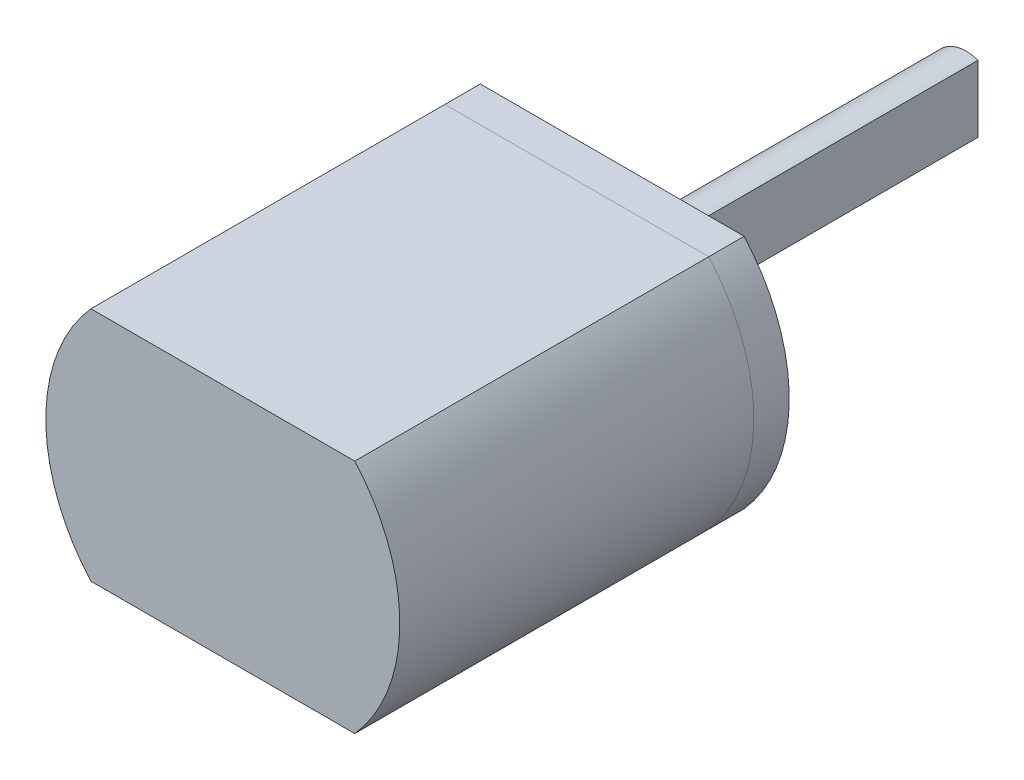
from build123d import *

# Parameters (mm, degrees)
BOSS_EXTRUDE1_DEPTH = 15
BOSS_EXTRUDE2_DEPTH = 1.5
BOSS_EXTRUDE3_DEPTH = 15


with BuildPart() as part:
    # Sketch1 → Boss-Extrude1 (new body)
    with BuildSketch(Plane.XY):
        with BuildLine():
            Line((-5.590169944, -5), (5.590169944, -5))
            ThreePointArc((5.590169944, -5), (7.5, 0), (5.590169944, 5))
            Line((5.590169944, 5), (-5.590169944, 5))
            ThreePointArc((-5.590169944, 5), (-7.5, 0), (-5.590169944, -5))
        make_face()
    extrude(amount=BOSS_EXTRUDE1_DEPTH)


with BuildPart() as body_2:
    # Sketch2 → Boss-Extrude2 (new body)
    with BuildSketch(Plane(origin=(0, 0, 0), x_dir=(-1, 0, 0), z_dir=(0, 0, -1))):
        with BuildLine():
            Line((5.590169944, -5), (-5.590169944, -5))
            ThreePointArc((-5.590169944, -5), (-7.5, 0), (-5.590169944, 5))
            Line((-5.590169944, 5), (5.590169944, 5))
            ThreePointArc((5.590169944, 5), (7.5, 0), (5.590169944, -5))
        make_face()
    extrude(amount=BOSS_EXTRUDE2_DEPTH)

    # Sketch3 → Boss-Extrude3 (add)
    with BuildSketch(Plane(origin=(0, 0, -1.5), x_dir=(-1, 0, 0), z_dir=(0, 0, -1))):
        with BuildLine():
            Line((-0.5, -1.414213562), (-0.5, 1.414213562))
            ThreePointArc((-0.5, 1.414213562), (1.5, 0), (-0.5, -1.414213562))
        make_face()
    extrude(amount=BOSS_EXTRUDE3_DEPTH)


solid = Compound([part.part, body_2.part])
